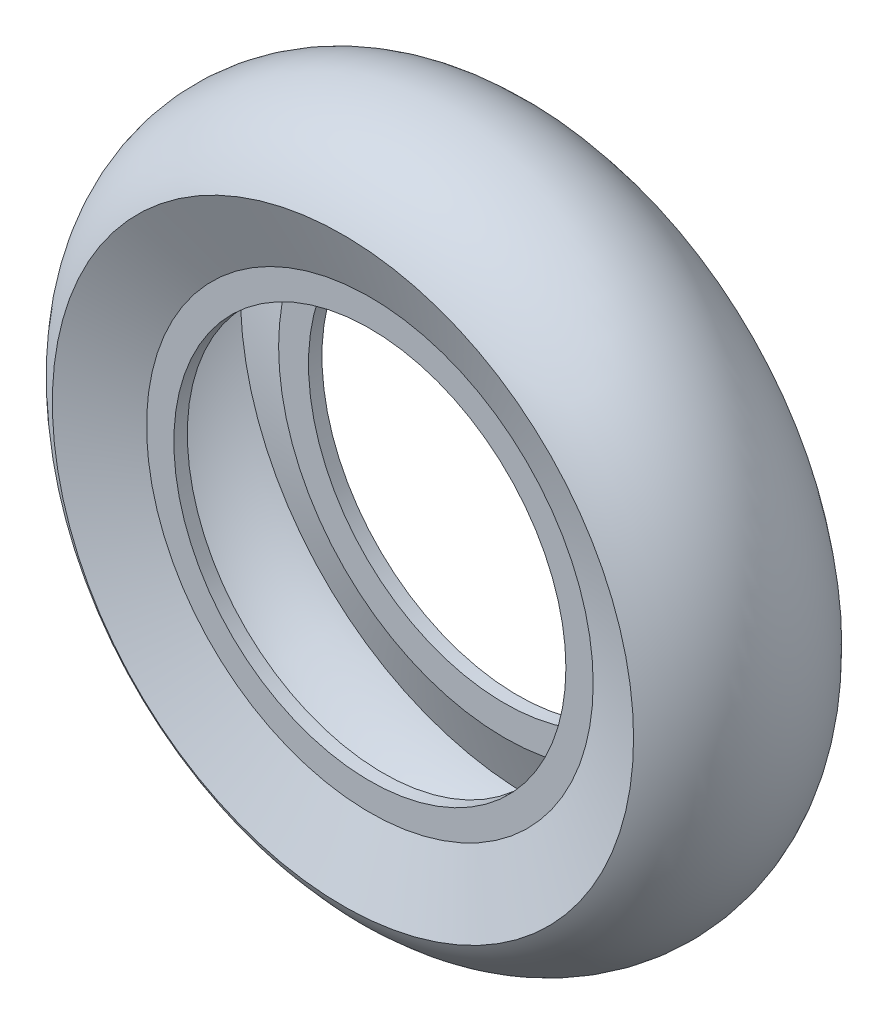
from build123d import *

# Parameters (mm, degrees)
SKETCH2_W           = 152.4
SKETCH2_H           = 12.7
CUT_EXTRUDE1_DEPTH  = 274.838219081
BOSS_EXTRUDE1_DEPTH = 2.54


with BuildPart() as part:
    # Sketch1 → Revolve-Thin1 (revolve)
    with BuildSketch(Plane(origin=(-82.316045308, -44.525823755, 136.652772686), x_dir=(0, 0, -1), z_dir=(1, 0, 0)), mode=Mode.PRIVATE) as revolve_thin1_sk:
        with BuildLine():
            Line((0, 46.228), (0, 52.664128902))
            Line((0, 52.664128902), (6.35, 68.539128902))
            ThreePointArc((6.35, 68.539128902), (-17.4625, 82.55), (-41.275, 68.539128902))
            Line((-41.275, 68.539128902), (-34.925, 52.664128902))
            Line((-34.925, 52.664128902), (-34.925, 46.228))
            Line((-34.925, 46.228), (-31.75, 46.228))
            Line((-31.75, 46.228), (-31.75, 53.275578033))
            Line((-31.75, 53.275578033), (-37.744847392, 68.262696512))
            ThreePointArc((-37.744847392, 68.262696512), (-17.4625, 79.375), (2.819847392, 68.262696512))
            Line((2.819847392, 68.262696512), (-3.175, 53.275578033))
            Line((-3.175, 53.275578033), (-3.175, 46.228))
            Line((-3.175, 46.228), (0, 46.228))
        make_face()
    revolve(revolve_thin1_sk.sketch.rotate(Axis((-82.316045308, -44.525823755, 136.652772686), (0, 0, -1)), 90), axis=Axis((-82.316045308, -44.525823755, 136.652772686), (0, 0, -1)))

    # Sketch2 → Cut-Extrude1 (cut, through all)
    with BuildSketch(Plane(origin=(0, 0, 0), x_dir=(-1, 0, 0), z_dir=(0, 0, -1))):
        with Locations((82.316045308, -127.075823755)):
            Rectangle(SKETCH2_W, SKETCH2_H)
    extrude(amount=-CUT_EXTRUDE1_DEPTH, mode=Mode.SUBTRACT)

    # Sketch3 → Boss-Extrude1 (add)
    with BuildSketch(Plane.XZ.offset(120.725823755)):
        with BuildLine():
            add(Edge.make_bspline(
                [(-82.316045308, 136.632769383), (-80.661779953, 136.632769383), (-79.018426178, 136.696617525), (-75.753750046, 136.953228692), (-74.132419264, 137.145942414), (-70.914189749, 137.674331832), (-69.317248873, 138.009760922), (-66.944103021, 138.643188933), (-66.156790627, 138.876193783), (-64.590743344, 139.392393986), (-63.810418853, 139.676195716), (-61.495152887, 140.612403105), (-60.004353244, 141.339644306), (-57.876117616, 142.641683832), (-57.184932498, 143.111926193), (-55.871981629, 144.119526956), (-55.247020036, 144.658550318), (-54.366285683, 145.530467857), (-54.082200293, 145.831717046), (-53.535305741, 146.457995837), (-53.271428052, 146.784557651), (-52.526928605, 147.78992469), (-52.091500212, 148.49496161), (-51.545343753, 149.613633677), (-51.380998344, 149.997335703), (-51.093109198, 150.785173958), (-50.971886645, 151.182858116), (-50.6772264, 152.387345089), (-50.572307131, 153.20550138), (-50.56331945, 154.457324185), (-50.585674892, 154.878788701), (-50.678788146, 155.705499652), (-50.749403526, 156.113885432), (-50.936614465, 156.921159097), (-51.053215797, 157.320045789), (-51.331168652, 158.108575352), (-51.492416964, 158.49711249), (-52.028836589, 159.625424136), (-52.459139879, 160.336721606), (-53.197655213, 161.351293107), (-53.458490079, 161.679191241), (-54.00031547, 162.309079357), (-54.282205107, 162.612311946), (-55.15736035, 163.490550296), (-55.779946093, 164.034273952), (-57.0907779, 165.051667258), (-57.781969063, 165.526598562), (-59.897592995, 166.834003306), (-61.375219748, 167.561796198), (-63.664054526, 168.498583435), (-64.439302551, 168.78452103), (-66.011673031, 169.309591721), (-66.809423716, 169.548712065), (-69.204393185, 170.195457467), (-70.812917358, 170.536650611), (-74.049152435, 171.073704417), (-75.676902704, 171.269266904), (-78.949559869, 171.530436691), (-80.594476489, 171.595970337), (-83.07447866, 171.598624054), (-83.903724268, 171.583377391), (-85.553158619, 171.520730932), (-86.374990756, 171.473360766), (-88.831698363, 171.282365893), (-90.457863986, 171.09029596), (-93.684431119, 170.562852996), (-95.284875678, 170.22771941), (-97.662126664, 169.594777231), (-98.450614593, 169.361942568), (-100.018584998, 168.846183822), (-100.799128259, 168.562872472), (-103.118100295, 167.626921106), (-104.610944852, 166.899823201), (-106.74157725, 165.598333674), (-107.434275388, 165.127791618), (-108.749709793, 164.119700738), (-109.375635243, 163.580536155), (-110.257448771, 162.708741082), (-110.54183309, 162.407589308), (-111.08921955, 161.78166568), (-111.353308531, 161.455392707), (-112.100242992, 160.448294519), (-112.536699028, 159.742436583), (-113.083849526, 158.623397679), (-113.248227056, 158.240295808), (-113.536953336, 157.451663588), (-113.658884833, 157.052425771), (-113.954571193, 155.845695868), (-114.059637057, 155.026722903), (-114.068826026, 153.774909594), (-114.046509087, 153.352616816), (-113.953228974, 152.524361985), (-113.882459403, 152.115385732), (-113.69491373, 151.30725469), (-113.578131478, 150.908101213), (-113.299889356, 150.119332027), (-113.138234439, 149.730072319), (-112.60061763, 148.600247577), (-112.169523758, 147.888458947), (-111.430116427, 146.873651319), (-111.168554513, 146.545150439), (-110.625532038, 145.914552851), (-110.343070249, 145.61105547), (-109.466302876, 144.732228321), (-108.842782777, 144.188383046), (-107.530438804, 143.171070392), (-106.838247133, 142.696021357), (-104.718483167, 141.387836901), (-103.238630723, 140.660192672), (-100.94719851, 139.723989723), (-100.171207934, 139.438314111), (-98.597589133, 138.913848696), (-97.798626609, 138.674842602), (-95.398611691, 138.028255524), (-93.786206575, 137.687279611), (-90.541337171, 137.151108191), (-88.908832462, 136.956206441), (-86.446597714, 136.761803146), (-85.623590372, 136.713444275), (-84.38575626, 136.665056639), (-83.972590179, 136.6529588), (-83.145150064, 136.636815189), (-82.729611646, 136.632769383), (-82.316045308, 136.632769383)],
                knots=[0, 0, 0, 0, 0.03125, 0.03125, 0.0625, 0.0625, 0.09375, 0.09375, 0.109375, 0.109375, 0.125, 0.125, 0.15625, 0.15625, 0.171875, 0.171875, 0.1875, 0.1875, 0.1953125, 0.1953125, 0.203125, 0.203125, 0.21875, 0.21875, 0.2265625, 0.2265625, 0.234375, 0.234375, 0.25, 0.25, 0.2578125, 0.2578125, 0.265625, 0.265625, 0.2734375, 0.2734375, 0.28125, 0.28125, 0.296875, 0.296875, 0.3046875, 0.3046875, 0.3125, 0.3125, 0.328125, 0.328125, 0.34375, 0.34375, 0.375, 0.375, 0.390625, 0.390625, 0.40625, 0.40625, 0.4375, 0.4375, 0.46875, 0.46875, 0.5, 0.5, 0.515625, 0.515625, 0.53125, 0.53125, 0.5625, 0.5625, 0.59375, 0.59375, 0.609375, 0.609375, 0.625, 0.625, 0.65625, 0.65625, 0.671875, 0.671875, 0.6875, 0.6875, 0.6953125, 0.6953125, 0.703125, 0.703125, 0.71875, 0.71875, 0.7265625, 0.7265625, 0.734375, 0.734375, 0.75, 0.75, 0.7578125, 0.7578125, 0.765625, 0.765625, 0.7734375, 0.7734375, 0.78125, 0.78125, 0.796875, 0.796875, 0.8046875, 0.8046875, 0.8125, 0.8125, 0.828125, 0.828125, 0.84375, 0.84375, 0.875, 0.875, 0.890625, 0.890625, 0.90625, 0.90625, 0.9375, 0.9375, 0.96875, 0.96875, 0.984375, 0.984375, 0.9921875, 0.9921875, 1, 1, 1, 1], degree=3))
        make_face()
    extrude(amount=-BOSS_EXTRUDE1_DEPTH)


solid = part.part
